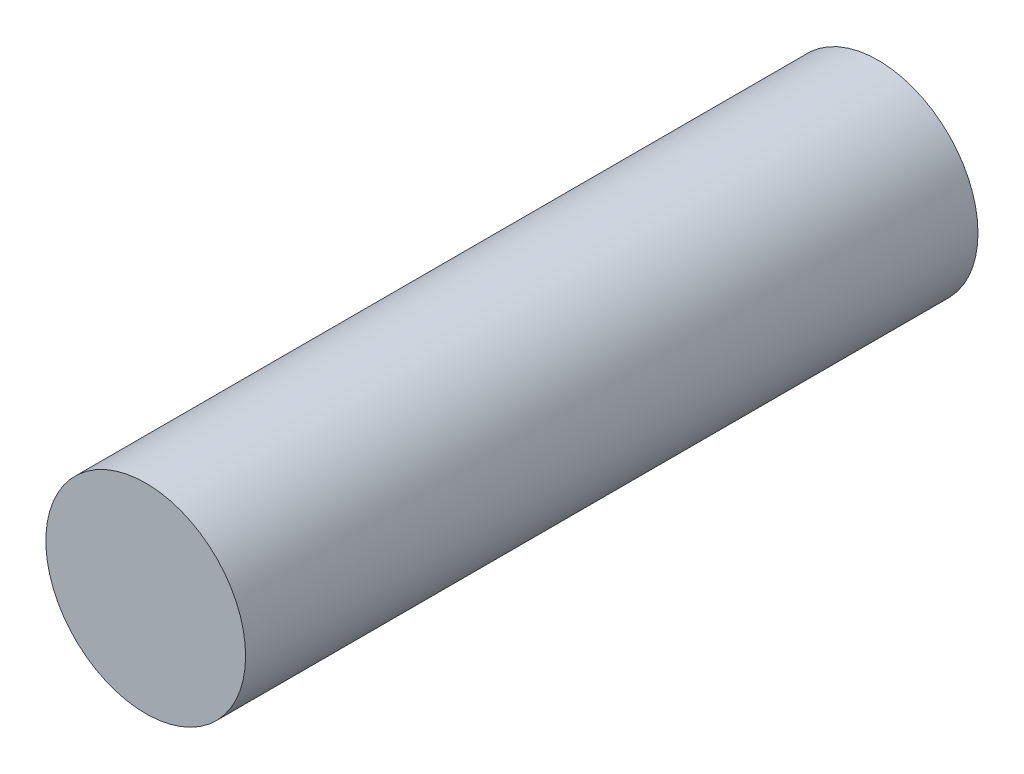
from build123d import *

# Parameters (mm, degrees)
SKETCH_1_R      = 6
EXTRUDE_1_DEPTH = 22


with BuildPart() as part:
    # 草图1 → 凸台-拉伸1 (new, symmetric)
    with BuildSketch(Plane.XY):
        Circle(SKETCH_1_R)
    extrude(amount=EXTRUDE_1_DEPTH, both=True)


solid = part.part
